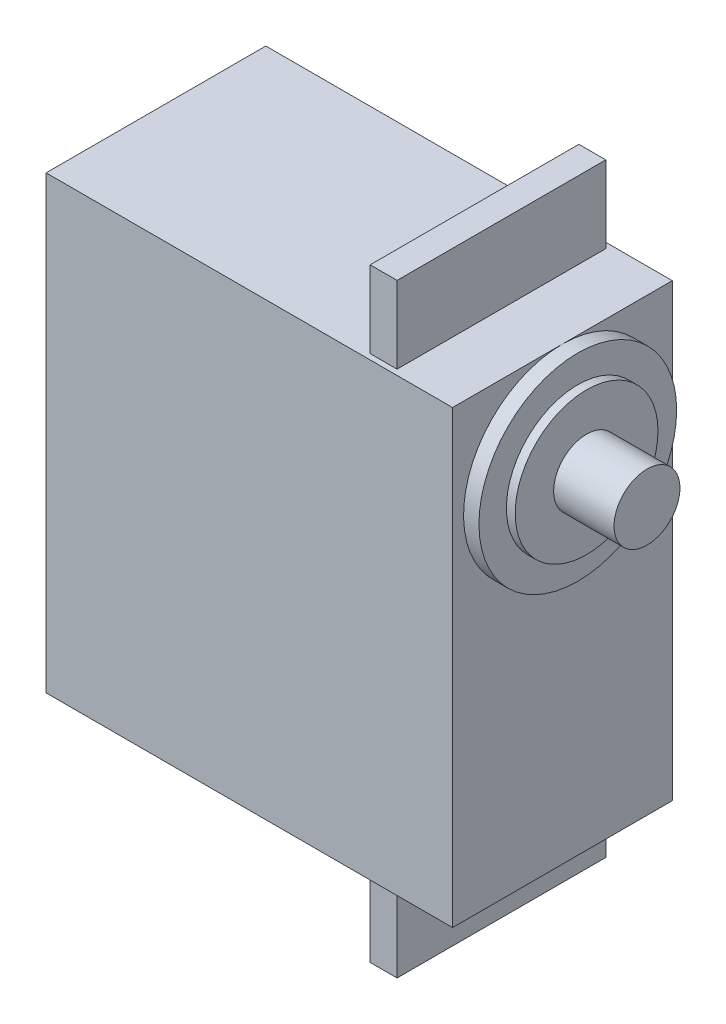
from build123d import *

# Parameters (mm, degrees)
SKETCH_1_W      = 20
SKETCH_1_H      = 41
EXTRUDE_1_DEPTH = 37
SKETCH_2_W      = 2.45
SKETCH_2_H      = 19
EXTRUDE_2_DEPTH = 7
SKETCH_3_W      = 2.45
SKETCH_3_H      = 19
EXTRUDE_3_DEPTH = 7
SKETCH_4_R      = 3
EXTRUDE_4_DEPTH = 7.7
SKETCH_5_R      = 9
EXTRUDE_5_DEPTH = 1.4
SKETCH_7_R      = 6.5
EXTRUDE_6_DEPTH = 0.8


with BuildPart() as part:
    # 草圖1 → 填料-伸長1 (new body)
    with BuildSketch(Plane(origin=(0, 0, 0), x_dir=(0, 0, -1), z_dir=(1, 0, 0))):
        with Locations((-1.083039195, -2.285391089)):
            Rectangle(SKETCH_1_W, SKETCH_1_H)
    extrude(amount=EXTRUDE_1_DEPTH)

    # 草圖2 → 填料-伸長2 (add)
    with BuildSketch(Plane(origin=(0, 18.214608911, 0), x_dir=(1, 0, 0), z_dir=(0, 1, 0))):
        with Locations((30.225, -1.083039195)):
            Rectangle(SKETCH_2_W, SKETCH_2_H)
    extrude(amount=EXTRUDE_2_DEPTH)

    # 草圖3 → 填料-伸長3 (add)
    with BuildSketch(Plane.XZ.offset(22.785391089)):
        with Locations((30.225, 1.083039195)):
            Rectangle(SKETCH_3_W, SKETCH_3_H)
    extrude(amount=EXTRUDE_3_DEPTH)

    # 草圖4 → 填料-伸長4 (add)
    with BuildSketch(Plane(origin=(37, 0, 0), x_dir=(0, 0, -1), z_dir=(1, 0, 0))):
        with Locations(Location((-1.083039195, 9.214608911, 0), (0, 0, 180))):
            Circle(SKETCH_4_R)
    extrude(amount=EXTRUDE_4_DEPTH)

    # 草圖5 → 填料-伸長5 (add)
    with BuildSketch(Plane(origin=(37, 0, 0), x_dir=(0, 0, -1), z_dir=(1, 0, 0))):
        with Locations(Location((-1.083039195, 9.214608911, 0), (0, 0, 90))):
            Circle(SKETCH_5_R)
    extrude(amount=EXTRUDE_5_DEPTH)

    # 草圖7 → 填料-伸長6 (add)
    with BuildSketch(Plane(origin=(38.4, 0, 0), x_dir=(0, 0, -1), z_dir=(1, 0, 0))):
        with Locations((-1.083039195, 9.214608911)):
            Circle(SKETCH_7_R)
    extrude(amount=EXTRUDE_6_DEPTH)


solid = part.part
